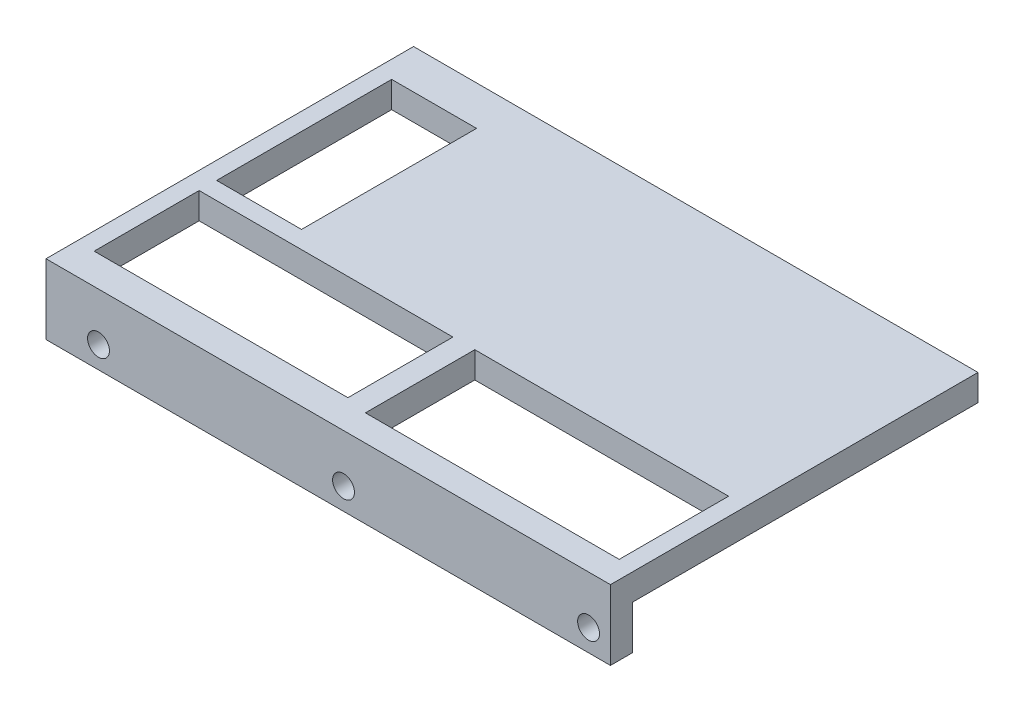
from build123d import *

# Parameters (mm, degrees)
SKETCH1_W           = 64.5
SKETCH1_H           = 42
BOSS_EXTRUDE1_DEPTH = 3
CUT_EXTRUDE1_REACH  = 79.028
SKETCH2_W           = 29
SKETCH2_H           = 12.5
SKETCH2_H_2         = 12
SKETCH2_W_2         = 9.7
SKETCH2_H_3         = 20
SKETCH5_W           = 64.5
SKETCH5_H           = 2.5
BOSS_EXTRUDE4_DEPTH = 5
CUT_EXTRUDE2_REACH  = 79.131
SKETCH4_R           = 1.25


with BuildPart() as part:
    # Sketch1 → Boss-Extrude1 (new body)
    with BuildSketch(Plane(origin=(0, 0, 0), x_dir=(1, 0, 0), z_dir=(0, 1, 0))):
        with Locations((32.25, 21)):
            Rectangle(SKETCH1_W, SKETCH1_H)
    extrude(amount=BOSS_EXTRUDE1_DEPTH)

    # Sketch2 → Cut-Extrude1 (cut, up to next)
    with BuildSketch(Plane(origin=(0, 3, 0), x_dir=(1, 0, 0), z_dir=(0, 1, 0)), mode=Mode.PRIVATE) as cut_extrude1_sk1:
        with Locations((48, 9.25)):
            Rectangle(SKETCH2_W, SKETCH2_H)
    cut_extrude1_tool1 = extrude(cut_extrude1_sk1.sketch, amount=-CUT_EXTRUDE1_REACH, mode=Mode.PRIVATE) & part.part
    # Sketch2 → Cut-Extrude1 (cut, up to next)
    with BuildSketch(Plane(origin=(0, 3, 0), x_dir=(1, 0, 0), z_dir=(0, 1, 0)), mode=Mode.PRIVATE) as cut_extrude1_sk2:
        with Locations((16.5, 9.5)):
            Rectangle(SKETCH2_W, SKETCH2_H_2)
    cut_extrude1_tool2 = extrude(cut_extrude1_sk2.sketch, amount=-CUT_EXTRUDE1_REACH, mode=Mode.PRIVATE) & part.part
    # Sketch2 → Cut-Extrude1 (cut, up to next)
    with BuildSketch(Plane(origin=(0, 3, 0), x_dir=(1, 0, 0), z_dir=(0, 1, 0)), mode=Mode.PRIVATE) as cut_extrude1_sk3:
        with Locations((6.85, 27.5)):
            Rectangle(SKETCH2_W_2, SKETCH2_H_3)
    cut_extrude1_tool3 = extrude(cut_extrude1_sk3.sketch, amount=-CUT_EXTRUDE1_REACH, mode=Mode.PRIVATE) & part.part
    add(cut_extrude1_tool1.solids().sort_by_distance((48, 3, -9.25))[0], mode=Mode.SUBTRACT)
    add(cut_extrude1_tool2.solids().sort_by_distance((16.5, 3, -9.5))[0], mode=Mode.SUBTRACT)
    add(cut_extrude1_tool3.solids().sort_by_distance((6.85, 3, -27.5))[0], mode=Mode.SUBTRACT)

    # Sketch5 → Boss-Extrude4 (add)
    with BuildSketch(Plane.XZ):
        with Locations((32.25, -1.25)):
            Rectangle(SKETCH5_W, SKETCH5_H)
    extrude(amount=BOSS_EXTRUDE4_DEPTH)

    # Sketch4 → Cut-Extrude2 (cut, up to next)
    with BuildSketch(Plane.XY, mode=Mode.PRIVATE) as cut_extrude2_sk1:
        with Locations((62, -2.5)):
            Circle(SKETCH4_R)
    cut_extrude2_tool1 = extrude(cut_extrude2_sk1.sketch, amount=-CUT_EXTRUDE2_REACH, mode=Mode.PRIVATE) & part.part
    # Sketch4 → Cut-Extrude2 (cut, up to next)
    with BuildSketch(Plane.XY, mode=Mode.PRIVATE) as cut_extrude2_sk2:
        with Locations((6, -2.5)):
            Circle(SKETCH4_R)
    cut_extrude2_tool2 = extrude(cut_extrude2_sk2.sketch, amount=-CUT_EXTRUDE2_REACH, mode=Mode.PRIVATE) & part.part
    # Sketch4 → Cut-Extrude2 (cut, up to next)
    with BuildSketch(Plane.XY, mode=Mode.PRIVATE) as cut_extrude2_sk3:
        with Locations((34, -2.5)):
            Circle(SKETCH4_R)
    cut_extrude2_tool3 = extrude(cut_extrude2_sk3.sketch, amount=-CUT_EXTRUDE2_REACH, mode=Mode.PRIVATE) & part.part
    add(cut_extrude2_tool1.solids().sort_by_distance((62, -2.5, 0))[0], mode=Mode.SUBTRACT)
    add(cut_extrude2_tool2.solids().sort_by_distance((6, -2.5, 0))[0], mode=Mode.SUBTRACT)
    add(cut_extrude2_tool3.solids().sort_by_distance((34, -2.5, 0))[0], mode=Mode.SUBTRACT)


solid = part.part
